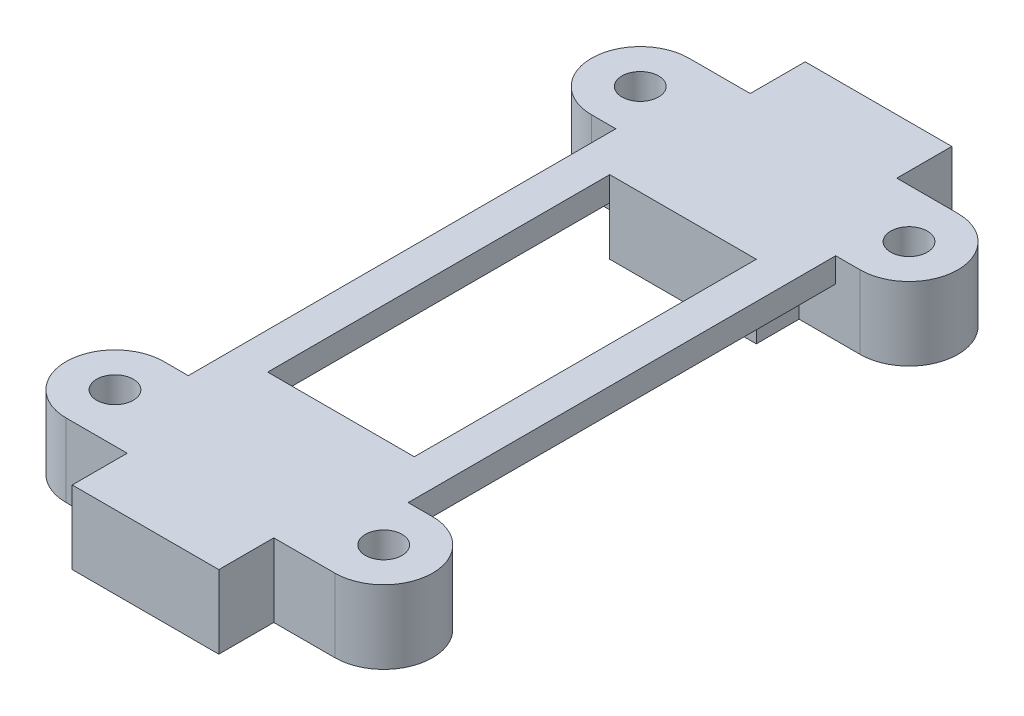
from build123d import *

# Parameters (mm, degrees)
SKETCH1_R           = 1.5
SKETCH1_W           = 12
SKETCH1_H           = 4.5
SKETCH1_H_2         = 3.5
BOSS_EXTRUDE1_DEPTH = 6
SKETCH3_W           = 3
SKETCH3_H           = 35
BOSS_EXTRUDE2_DEPTH = 2


with BuildPart() as part:
    # Sketch1 → Boss-Extrude1 (new body)
    # profile 1 of 4: a face of its own
    with BuildSketch(Plane(origin=(0, 0, 0), x_dir=(1, 0, 0), z_dir=(0, 1, 0))):
        with BuildLine():
            Line((11, -4), (-11, -4))
            ThreePointArc((-11, -4), (-15, 0), (-11, 4))
            Line((-11, 4), (11, 4))
            ThreePointArc((11, 4), (15, 0), (11, -4))
        make_face()
        with Locations(Location((11, 0, 0), (0, 0, 270))):
            Circle(SKETCH1_R, mode=Mode.SUBTRACT)
        with Locations(Location((-11, 0, 0), (0, 0, 270))):
            Circle(SKETCH1_R, mode=Mode.SUBTRACT)
    # profile 2 of 4: a face of its own
    with BuildSketch(Plane(origin=(0, 0, 0), x_dir=(1, 0, 0), z_dir=(0, 1, 0))):
        with Locations((0, 6.25)):
            Rectangle(SKETCH1_W, SKETCH1_H)
    # profile 3 of 4: a face of its own
    with BuildSketch(Plane(origin=(0, 0, 0), x_dir=(1, 0, 0), z_dir=(0, 1, 0))):
        with Locations((0, -5.75)):
            Rectangle(SKETCH1_W, SKETCH1_H_2)
    # profile 4 of 4: a face of its own
    with BuildSketch(Plane(origin=(0, 0, 0), x_dir=(1, 0, 0), z_dir=(0, 1, 0))):
        with BuildLine():
            Line((6, -47), (6, -51.5))
            Line((6, -51.5), (-6, -51.5))
            Line((-6, -51.5), (-6, -47))
            Line((-6, -47), (-11, -47))
            ThreePointArc((-11, -47), (-15, -43), (-11, -39))
            Line((-11, -39), (-6, -39))
            Line((-6, -39), (-6, -35.5))
            Line((-6, -35.5), (6, -35.5))
            Line((6, -35.5), (6, -39))
            Line((6, -39), (11, -39))
            ThreePointArc((11, -39), (15, -43), (11, -47))
            Line((11, -47), (6, -47))
        make_face()
        with Locations(Location((-11, -43, 0), (0, 0, 90))):
            Circle(SKETCH1_R, mode=Mode.SUBTRACT)
        with Locations(Location((11, -43, 0), (0, 0, 90))):
            Circle(SKETCH1_R, mode=Mode.SUBTRACT)
    extrude(amount=BOSS_EXTRUDE1_DEPTH)

    # Sketch3 → Boss-Extrude2 (add)
    with BuildSketch(Plane(origin=(0, 6, 0), x_dir=(1, 0, 0), z_dir=(0, 1, 0))):
        with Locations((7.5, -21.5)):
            Rectangle(SKETCH3_W, SKETCH3_H)
        with Locations((-7.5, -21.5)):
            Rectangle(SKETCH3_W, SKETCH3_H)
    extrude(amount=-BOSS_EXTRUDE2_DEPTH)


solid = part.part
